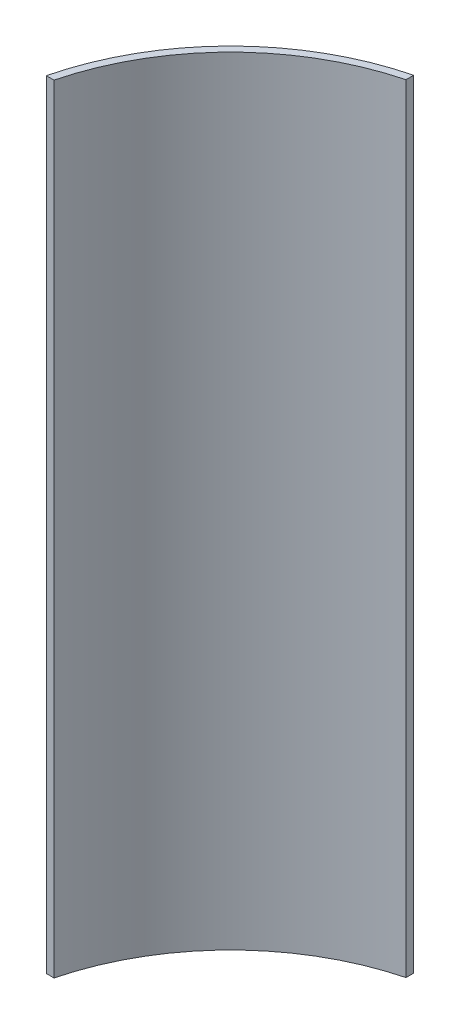
from build123d import *

# Parameters (mm, degrees)
EXTRUDE_1_DEPTH = 125


with BuildPart() as part:
    # Эскиз1 → Бобышка-Вытянуть1 (new body)
    with BuildSketch(Plane(origin=(0, 0, 0), x_dir=(1, 0, 0), z_dir=(0, 1, 0))):
        with BuildLine():
            Line((-39.321241079, 9.7), (-38.084117424, 9.7))
            ThreePointArc((-38.084117424, 9.7), (-27.845497037, 27.732982075), (-9.854117424, 38.044531404))
            Line((-9.854117424, 38.044531404), (-9.854117424, 39.282901749))
            ThreePointArc((-9.854117424, 39.282901749), (-28.693919041, 28.581620144), (-39.321241079, 9.7))
        make_face()
    extrude(amount=EXTRUDE_1_DEPTH)


solid = part.part
